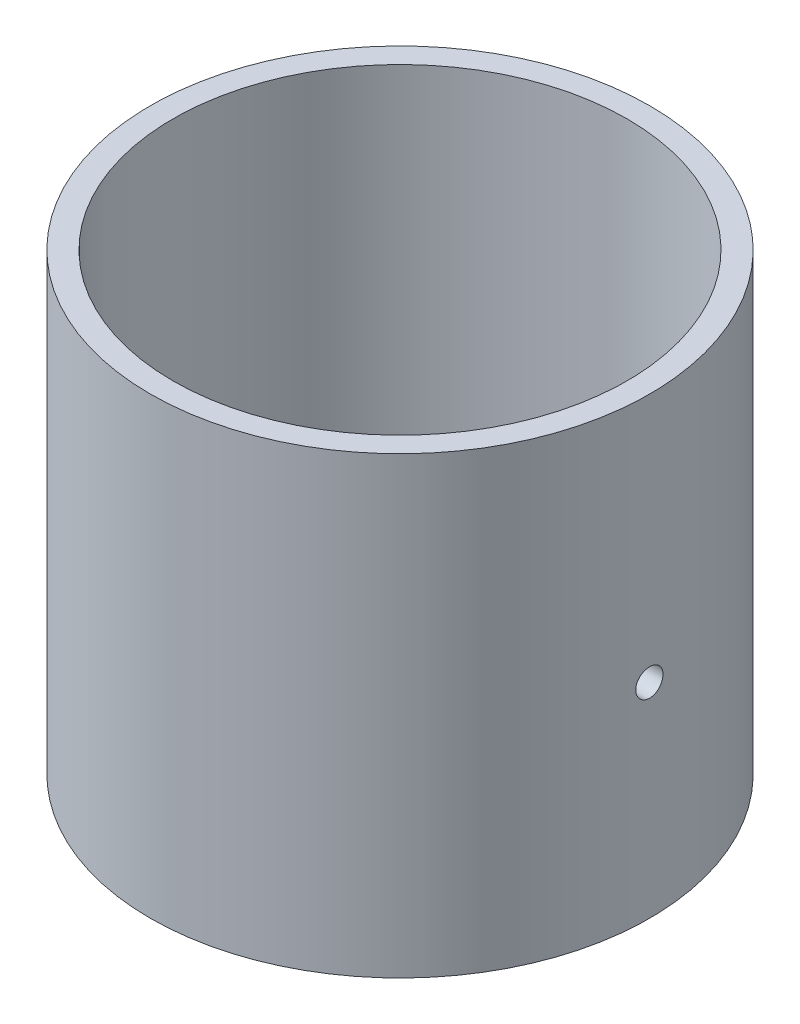
from build123d import *

# Parameters (mm, degrees)
SKETCH2_W          = 55
SKETCH2_H          = 100
SKETCH3_R          = 50
CUT_EXTRUDE2_DEPTH = 95
SKETCH5_R          = 3
CUT_EXTRUDE4_DEPTH = 49


with BuildPart() as part:
    # Sketch2 → Revolve1 (revolve)
    with BuildSketch(Plane.XY, mode=Mode.PRIVATE) as revolve1_sk:
        with Locations((-10.224323353, 29.074307692)):
            Rectangle(SKETCH2_W, SKETCH2_H)
    revolve(revolve1_sk.sketch.rotate(Axis((17.275676647, -20.925692308, 0), (0, 1, 0)), 270), axis=Axis((17.275676647, -20.925692308, 0), (0, 1, 0)))

    # Sketch3 → Cut-Extrude2 (cut)
    with BuildSketch(Plane(origin=(0, 79.074307692, 0), x_dir=(1, 0, 0), z_dir=(0, 1, 0))):
        with Locations(Location((17.275676647, 0, 0), (0, 0, 270))):
            Circle(SKETCH3_R)
    extrude(amount=-CUT_EXTRUDE2_DEPTH, mode=Mode.SUBTRACT)

    # Sketch5 → Cut-Extrude4 (cut)
    with BuildSketch(Plane(origin=(75, 0, 0), x_dir=(0, 0, -1), z_dir=(1, 0, 0))):
        with Locations((0, 24.074307692)):
            Circle(SKETCH5_R)
    extrude(amount=-CUT_EXTRUDE4_DEPTH, mode=Mode.SUBTRACT)


solid = part.part
